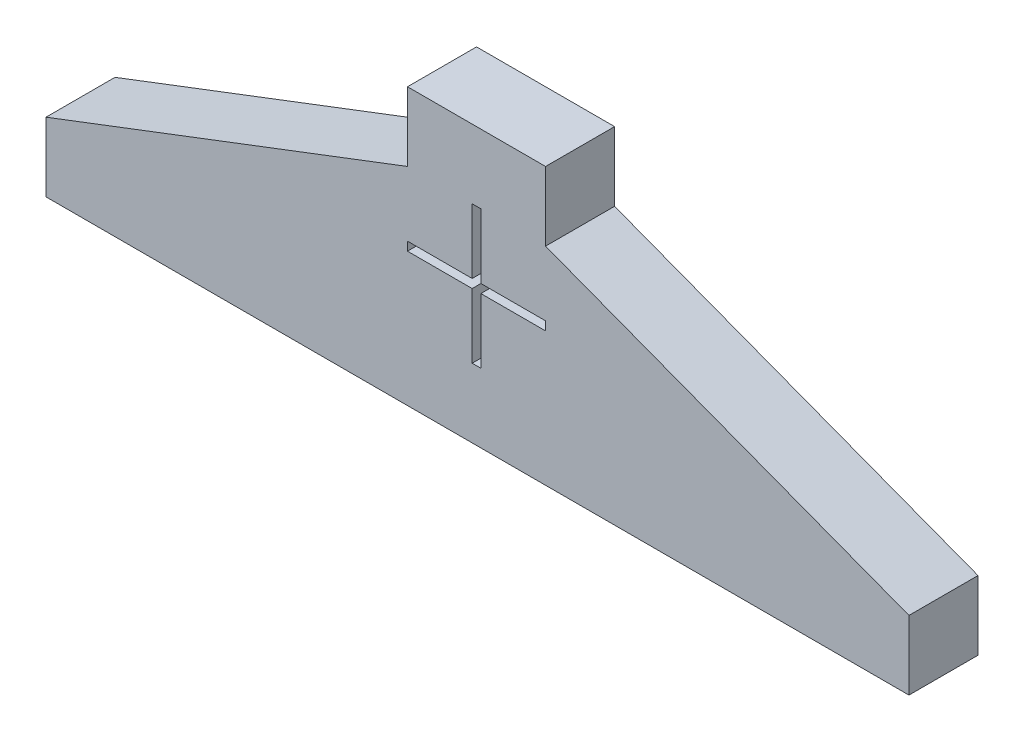
from build123d import *

# Parameters (mm, degrees)
SKETCH1_W           = 39.69
SKETCH1_H           = 3.175
BOSS_EXTRUDE1_DEPTH = 12.7
SKETCH3_W           = 6.35
SKETCH3_H           = 0.4
SKETCH3_W_2         = 0.4
SKETCH3_H_2         = 6.35
CUT_EXTRUDE7_DEPTH  = 3.175
CUT_EXTRUDE8_DEPTH  = 3.175


with BuildPart() as part:
    # Sketch1 → Boss-Extrude1 (new body)
    with BuildSketch(Plane(origin=(0, 0, 0), x_dir=(1, 0, 0), z_dir=(0, 1, 0))):
        Rectangle(SKETCH1_W, SKETCH1_H)
    extrude(amount=BOSS_EXTRUDE1_DEPTH)

    # Sketch3 → Cut-Extrude7 (cut)
    with BuildSketch(Plane.XY.offset(1.5875)):
        with Locations((-0.043891751, 6.35)):
            Rectangle(SKETCH3_W, SKETCH3_H)
        with Locations((-0.043891751, 6.35)):
            Rectangle(SKETCH3_W_2, SKETCH3_H_2)
    extrude(amount=-CUT_EXTRUDE7_DEPTH, mode=Mode.SUBTRACT)

    # Sketch6 → Cut-Extrude8 (cut)
    with BuildSketch(Plane.XY.offset(1.5875)):
        Polygon((-3.218891751, 9.525), (-3.218891751, 12.7), (-19.845, 12.7), (-19.845, 3.175), align=None)
        Polygon((19.845, 12.7), (3.131108249, 12.7), (3.131108249, 9.525), (19.845, 3.175), align=None)
    extrude(amount=-CUT_EXTRUDE8_DEPTH, mode=Mode.SUBTRACT)


solid = part.part
